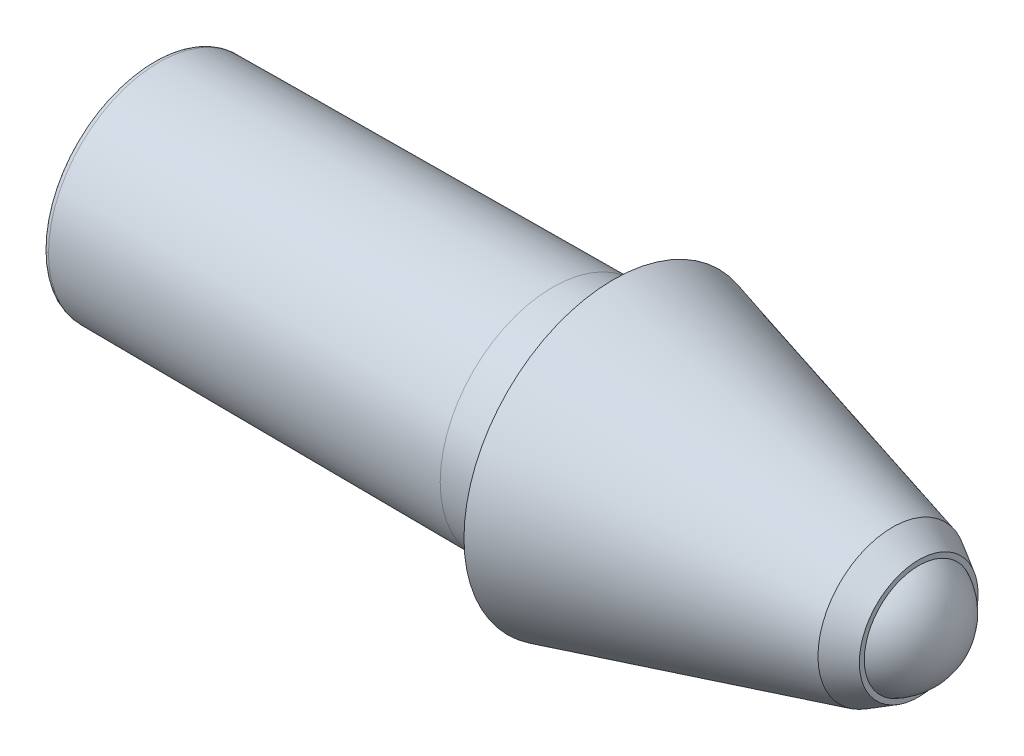
from build123d import *


with BuildPart() as part:
    # Sketch1 → Base-Revolve (revolve)
    with BuildSketch(Plane.XY, mode=Mode.PRIVATE) as base_revolve_sk:
        with BuildLine():
            Line((0, 0.45), (0, 0.860277006))
            ThreePointArc((0, 0.860277006), (0.014645207, 0.8956318), (0.05, 0.910276235))
            Line((0.05, 0.910276235), (3.3, 0.928238764))
            Line((3.3, 0.928238764), (3.8, 0.928238764))
            Line((3.8, 0.928238764), (3.8, 1.15))
            Line((3.8, 1.15), (3.8, 1.232219263))
            Line((3.8, 1.232219263), (6.103493649, 0.615))
            Line((6.103493649, 0.615), (6.32, 0.49))
            Line((6.32, 0.49), (6.32, 0.448998886))
            ThreePointArc((6.32, 0.448998886), (6.212917131, 0.487082869), (6.1, 0.5))
            Line((6.1, 0.5), (5.892893219, 0.5))
            Line((5.892893219, 0.5), (5.642893219, 0.25))
            Line((5.642893219, 0.25), (5.08660254, 0.25))
            Line((5.08660254, 0.25), (5, 0.4))
            Line((5, 0.4), (3.728867513, 0.4))
            Line((3.728867513, 0.4), (3.7, 0.45))
            Line((3.7, 0.45), (0, 0.45))
        make_face()
    revolve(base_revolve_sk.sketch.rotate(Axis((-2, 0, 0), (1, 0, 0)), 90), axis=Axis((-2, 0, 0), (1, 0, 0)))


with BuildPart() as body_2:
    # Sketch2 → Revolução3 (revolve)
    with BuildSketch(Plane.XY):
        with BuildLine():
            Line((5.6, 0), (6.6, 0))
            ThreePointArc((6.6, 0), (6.1, 0.5), (5.6, 0))
        make_face()
    revolve(axis=Axis((4.428375383, 0, 0), (1, 0, 0)))


solid = Compound([part.part, body_2.part])
